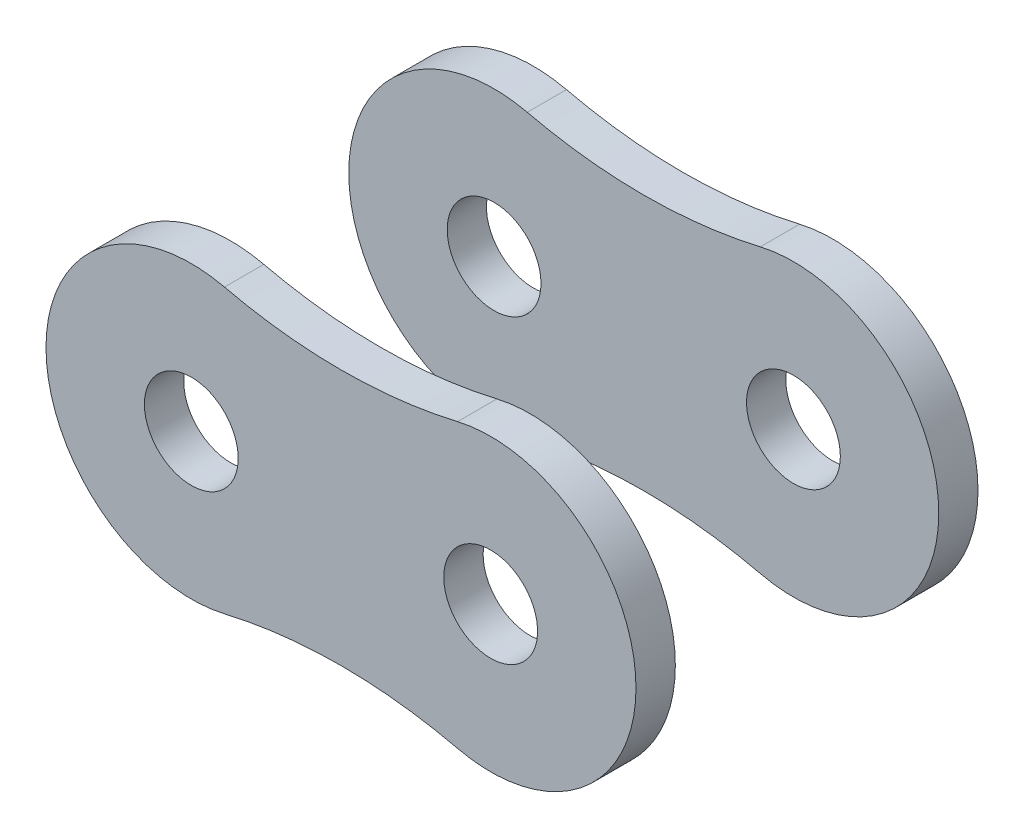
from build123d import *

# Parameters (mm, degrees)
EXTRUDE_1_DEPTH     = 1.665
SKETCH_3_R          = 1.99
CUT_EXTRUDE_1_DEPTH = 15.050077402
SKETCH_4_R          = 1.99
EXTRUDE_1_2_DEPTH   = 1.67


with BuildPart() as part:
    # 草图2 → Extrude 1 (new body)
    with BuildSketch(Plane.XY):
        with BuildLine():
            ThreePointArc((-4.944493019, 6.002647343), (-12.515, 0), (-4.944493019, -6.002647343))
            ThreePointArc((-4.944493019, -6.002647343), (0, -5.4315), (4.944493019, -6.002647343))
            ThreePointArc((4.944493019, -6.002647343), (12.515, 0), (4.944493019, 6.002647343))
            ThreePointArc((4.944493019, 6.002647343), (0, 5.4315), (-4.944493019, 6.002647343))
        make_face()
    extrude(amount=EXTRUDE_1_DEPTH)

    # 草图3 → 切除-拉伸1 (cut, through all)
    with BuildSketch(Plane.XY.offset(1.665)):
        with Locations((-6.35, 0)):
            Circle(SKETCH_3_R)
        with Locations((6.35, 0)):
            Circle(SKETCH_3_R)
    extrude(amount=-CUT_EXTRUDE_1_DEPTH, mode=Mode.SUBTRACT)


with BuildPart() as body_2:
    # 草图4 → Extrude 1 2 (new body)
    with BuildSketch(Plane(origin=(0, 0, 14.51), x_dir=(-1, 0, 0), z_dir=(0, 0, -1))):
        with BuildLine():
            ThreePointArc((4.944493019, -6.002647343), (12.515, 0), (4.944493019, 6.002647343))
            ThreePointArc((4.944493019, 6.002647343), (0, 5.4315), (-4.944493019, 6.002647343))
            ThreePointArc((-4.944493019, 6.002647343), (-12.515, 0), (-4.944493019, -6.002647343))
            ThreePointArc((-4.944493019, -6.002647343), (0, -5.4315), (4.944493019, -6.002647343))
        make_face()
        with Locations((6.35, 0)):
            Circle(SKETCH_4_R, mode=Mode.SUBTRACT)
        with Locations((-6.35, 0)):
            Circle(SKETCH_4_R, mode=Mode.SUBTRACT)
    extrude(amount=EXTRUDE_1_2_DEPTH)


solid = Compound([part.part, body_2.part])
